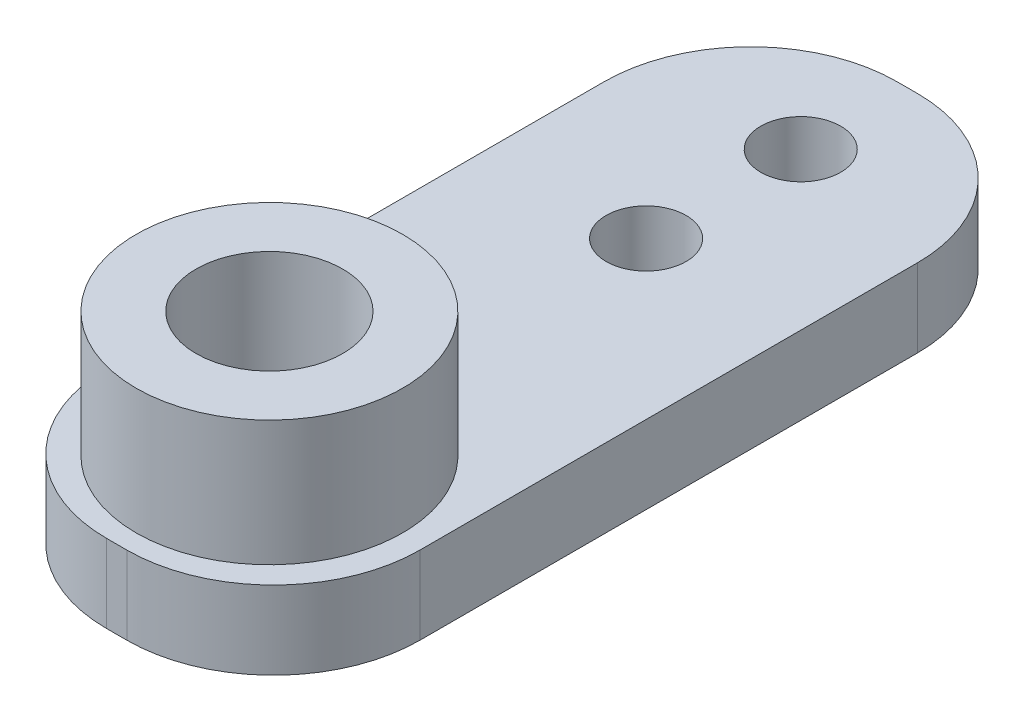
from build123d import *

# Parameters (mm, degrees)
BOSS_EXTRUDE1_DEPTH = 2.93
SKETCH2_R           = 5
BOSS_EXTRUDE2_DEPTH = 4.7
CUT_EXTRUDE1_REACH  = 34.806
SKETCH3_R           = 2.75
CUT_EXTRUDE2_REACH  = 34.251
SKETCH4_R           = 1.5


with BuildPart() as part:
    # Sketch1 → Boss-Extrude1 (new body)
    with BuildSketch(Plane(origin=(0, 0, 0), x_dir=(1, 0, 0), z_dir=(0, 1, 0))):
        with BuildLine():
            Line((-5.5, 0), (-6.26, 0))
            ThreePointArc((-6.26, 0), (-10.149087297, -1.610912703), (-11.76, -5.5))
            Line((-11.76, -5.5), (-11.76, -24.16))
            ThreePointArc((-11.76, -24.16), (-10.149087297, -28.049087297), (-6.26, -29.66))
            Line((-6.26, -29.66), (-5.5, -29.66))
            ThreePointArc((-5.5, -29.66), (-1.610912703, -28.049087297), (0, -24.16))
            Line((0, -24.16), (0, -5.5))
            ThreePointArc((0, -5.5), (-1.610912703, -1.610912703), (-5.5, 0))
        make_face()
    extrude(amount=BOSS_EXTRUDE1_DEPTH)

    # Sketch2 → Boss-Extrude2 (add)
    with BuildSketch(Plane(origin=(0, 2.93, 0), x_dir=(1, 0, 0), z_dir=(0, 1, 0))):
        with Locations(Location((-5.88, -23.93, 0), (0, 0, 270))):
            Circle(SKETCH2_R)
    extrude(amount=BOSS_EXTRUDE2_DEPTH)

    # Sketch3 → Cut-Extrude1 (cut, up to next)
    with BuildSketch(Plane(origin=(0, 7.63, 0), x_dir=(1, 0, 0), z_dir=(0, 1, 0)), mode=Mode.PRIVATE) as cut_extrude1_sk1:
        with Locations(Location((-5.88, -23.93, 0), (0, 0, 270))):
            Circle(SKETCH3_R)
    cut_extrude1_tool1 = extrude(cut_extrude1_sk1.sketch, amount=-CUT_EXTRUDE1_REACH, mode=Mode.PRIVATE) & part.part
    add(cut_extrude1_tool1.solids().sort_by_distance((-5.88, 7.63, 23.93))[0], mode=Mode.SUBTRACT)

    # Sketch4 → Cut-Extrude2 (cut, up to next)
    with BuildSketch(Plane(origin=(0, 2.93, 0), x_dir=(1, 0, 0), z_dir=(0, 1, 0)), mode=Mode.PRIVATE) as cut_extrude2_sk1:
        with Locations(Location((-5.88, -4, 0), (0, 0, 270))):
            Circle(SKETCH4_R)
    cut_extrude2_tool1 = extrude(cut_extrude2_sk1.sketch, amount=-CUT_EXTRUDE2_REACH, mode=Mode.PRIVATE) & part.part
    # Sketch4 → Cut-Extrude2 (cut, up to next)
    with BuildSketch(Plane(origin=(0, 2.93, 0), x_dir=(1, 0, 0), z_dir=(0, 1, 0)), mode=Mode.PRIVATE) as cut_extrude2_sk2:
        with Locations(Location((-5.88, -9.8, 0), (0, 0, 270))):
            Circle(SKETCH4_R)
    cut_extrude2_tool2 = extrude(cut_extrude2_sk2.sketch, amount=-CUT_EXTRUDE2_REACH, mode=Mode.PRIVATE) & part.part
    add(cut_extrude2_tool1.solids().sort_by_distance((-5.88, 2.93, 4))[0], mode=Mode.SUBTRACT)
    add(cut_extrude2_tool2.solids().sort_by_distance((-5.88, 2.93, 9.8))[0], mode=Mode.SUBTRACT)


solid = part.part
